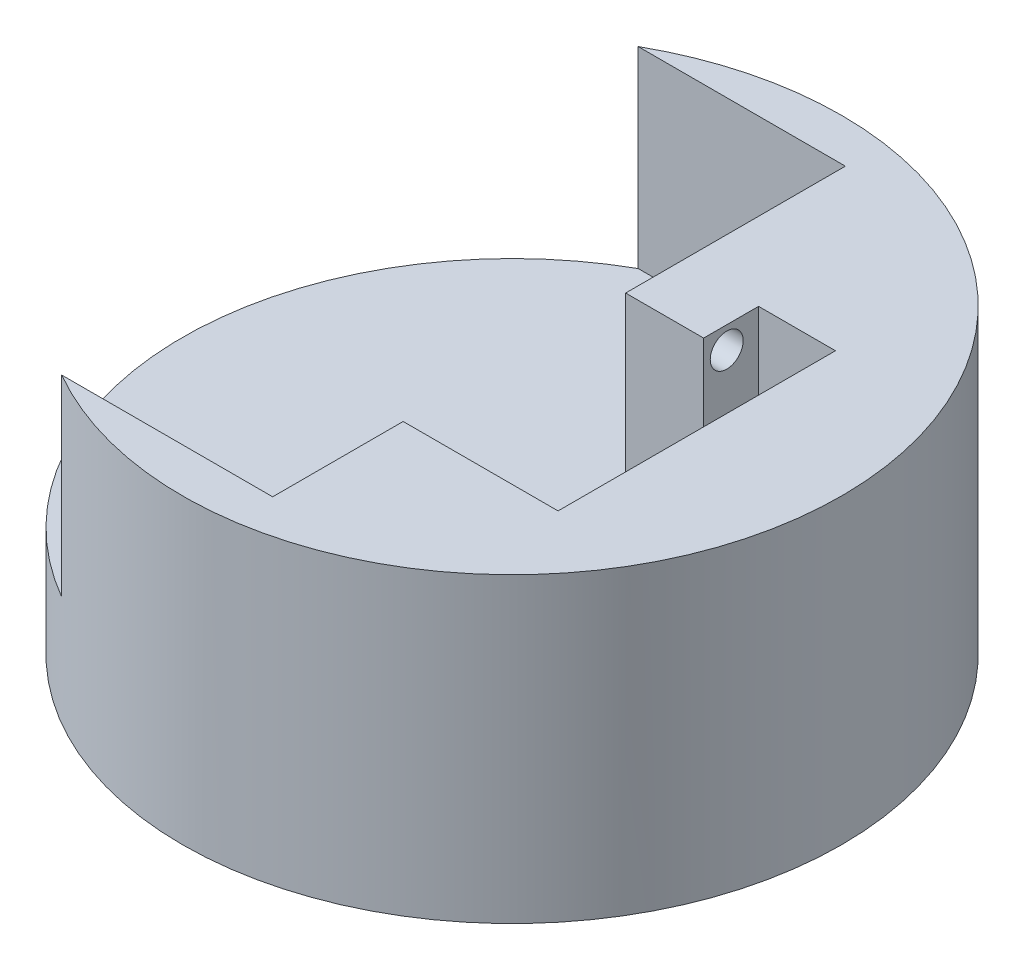
from build123d import *

# Parameters (mm, degrees)
SKETCH2_R           = 60
BOSS_EXTRUDE1_DEPTH = 30
BOSS_EXTRUDE2_START = 10
SKETCH9_R           = 60
BOSS_EXTRUDE2_DEPTH = 10
CUT_EXTRUDE23_DEPTH = 2
BOSS_EXTRUDE5_START = 15
SKETCH15_R          = 60
BOSS_EXTRUDE5_DEPTH = 15
CUT_EXTRUDE25_DEPTH = 35
SKETCH17_R          = 3
CUT_EXTRUDE26_DEPTH = 23
SKETCH18_R          = 52.258613217
CUT_EXTRUDE27_DEPTH = 5
BOSS_EXTRUDE7_DEPTH = 2


with BuildPart() as part:
    # Sketch2 → Boss-Extrude1 (new body)
    with BuildSketch(Plane(origin=(0, 0, 0), x_dir=(1, 0, 0), z_dir=(0, 1, 0))):
        with Locations(Location((0, 0, 0), (0, 0, 270))):
            Circle(SKETCH2_R)
    extrude(amount=BOSS_EXTRUDE1_DEPTH)

    # Sketch9 → Boss-Extrude2 (add)
    with BuildSketch(Plane(origin=(0, 0, 0), x_dir=(-1, 0, 0), z_dir=(0, -1, 0)).offset(BOSS_EXTRUDE2_START)):
        with Locations(Location((0, 0, 0), (0, 0, 90))):
            Circle(SKETCH9_R)
    extrude(amount=-BOSS_EXTRUDE2_DEPTH)

    # Sketch10 → Cut-Extrude23 (cut)
    with BuildSketch(Plane.XZ.offset(10)):
        with BuildLine():
            Line((0, 0), (9.846066319, 0))
            Line((9.846066319, 0), (12.609620792, -2.763554473))
            Line((12.609620792, -2.763554473), (19.082885562, -2.763554473))
            Line((19.082885562, -2.763554473), (20.727798578, 1.93826551))
            Line((20.727798578, 1.93826551), (21.803318626, 0.862745462))
            Line((21.803318626, 0.862745462), (27.750311837, 0.862745462))
            Line((27.750311837, 0.862745462), (28.825831886, 1.93826551))
            Line((28.825831886, 1.93826551), (30.470744902, -2.763554473))
            Line((30.470744902, -2.763554473), (36.944009671, -2.763554473))
            Line((36.944009671, -2.763554473), (39.707564144, 0))
            Line((39.707564144, 0), (49.553630464, 0))
            ThreePointArc((49.553630464, 0), (42.261211549, -3.211698163), (39.707564144, -10.759761734))
            ThreePointArc((39.707564144, -10.759761734), (32.871459875, -12.672701881), (27.1831321, -16.919416931))
            Line((27.1831321, -16.919416931), (25.802519728, -14.051991236))
            Line((25.802519728, -14.051991236), (23.751110736, -14.051991236))
            Line((23.751110736, -14.051991236), (22.370498364, -16.919416931))
            ThreePointArc((22.370498364, -16.919416931), (16.682170589, -12.672701881), (9.846066319, -10.759761734))
            ThreePointArc((9.846066319, -10.759761734), (7.292418915, -3.211698163), (0, 0))
        make_face()
    extrude(amount=-CUT_EXTRUDE23_DEPTH, mode=Mode.SUBTRACT)

    # Sketch15 → Boss-Extrude5 (add)
    with BuildSketch(Plane(origin=(0, -10, 0), x_dir=(-1, 0, 0), z_dir=(0, -1, 0)).offset(BOSS_EXTRUDE5_START)):
        with Locations(Location((0, 0, 0), (0, 0, 90))):
            Circle(SKETCH15_R)
    extrude(amount=-BOSS_EXTRUDE5_DEPTH)

    # Sketch3 → Cut-Extrude25 (cut)
    with BuildSketch(Plane(origin=(0, 30, 0), x_dir=(1, 0, 0), z_dir=(0, 1, 0))):
        with BuildLine():
            Line((22.548874047, 12.322345615), (8.348874047, 12.322345615))
            Line((8.348874047, 12.322345615), (8.348874047, 22.322345615))
            Line((8.348874047, 22.322345615), (8.348874047, 52.322345615))
            Line((8.348874047, 52.322345615), (5.968874047, 52.322345615))
            Line((5.968874047, 52.322345615), (-19.031125953, 52.322345615))
            Line((-19.031125953, 52.322345615), (-29.366173556, 52.322345615))
            ThreePointArc((-29.366173556, 52.322345615), (-81.494201087, 0.194318085), (-29.366173556, -51.933709446))
            Line((-29.366173556, -51.933709446), (-19.031125953, -51.933709446))
            Line((-19.031125953, -51.933709446), (5.968874047, -51.933709446))
            Line((5.968874047, -51.933709446), (8.348874047, -51.933709446))
            Line((8.348874047, -51.933709446), (8.348874047, -41.177654385))
            Line((8.348874047, -41.177654385), (8.348874047, -28.177654385))
            Line((8.348874047, -28.177654385), (36.548874047, -28.177654385))
            Line((36.548874047, -28.177654385), (36.548874047, 12.322345615))
            Line((36.548874047, 12.322345615), (36.548874047, 22.322345615))
            Line((36.548874047, 22.322345615), (22.548874047, 22.322345615))
            Line((22.548874047, 22.322345615), (22.548874047, 12.322345615))
        make_face()
    extrude(amount=-CUT_EXTRUDE25_DEPTH, mode=Mode.SUBTRACT)

    # Sketch17 → Cut-Extrude26 (cut)
    with BuildSketch(Plane.ZY.offset(-8.348874047)):
        with Locations((-16.522345615, 26)):
            Circle(SKETCH17_R)
        with Locations((32.377654385, 26)):
            Circle(SKETCH17_R)
    extrude(amount=-CUT_EXTRUDE26_DEPTH, mode=Mode.SUBTRACT)

    # Sketch18 → Cut-Extrude27 (cut)
    with BuildSketch(Plane.XZ.offset(25)):
        with Locations(Location((0, 0, 0), (0, 0, 270))):
            Circle(SKETCH18_R)
    extrude(amount=-CUT_EXTRUDE27_DEPTH, mode=Mode.SUBTRACT)

    # Sketch19 → Boss-Extrude7 (add)
    # profile 1 of 6: a face of its own
    with BuildSketch(Plane.ZY.offset(-8.348874047)):
        with BuildLine():
            Line((-45.204952465, -0.091098514), (-44.522059837, -0.091098514))
            add(Edge.make_bspline(
                [(-44.522059837, -0.091098514), (-44.488631358, -0.091274264), (-44.423838648, -0.091614912), (-44.329619206, -0.096898043), (-44.241370396, -0.104101713), (-44.159066623, -0.115531806), (-44.082745921, -0.129323583), (-44.012178284, -0.146025399), (-43.947588111, -0.166052013), (-43.870475375, -0.197898294), (-43.782554714, -0.245221462), (-43.687356321, -0.315150027), (-43.605952082, -0.400682491), (-43.535765765, -0.497165146), (-43.479964645, -0.603300918), (-43.439595348, -0.716560107), (-43.414037473, -0.835481848), (-43.411409038, -0.917125026), (-43.41008067, -0.958386174)],
                knots=[0, 0, 0, 0, 1.001505555, 1.941167018, 2.826882275, 3.653841531, 4.429895133, 5.150066043, 5.825578002, 6.45369114, 7.647487171, 8.808567382, 9.977351308, 11.170798116, 12.373658725, 13.556498008, 14.765093433, 16, 16, 16, 16], degree=3))
            add(Edge.make_bspline(
                [(-43.41008067, -0.958386174), (-43.411173888, -0.99703873), (-43.413322166, -1.072994647), (-43.433864925, -1.184088756), (-43.466025594, -1.289839975), (-43.510730843, -1.38986236), (-43.568832839, -1.481895973), (-43.637691158, -1.566683239), (-43.72076796, -1.640634296), (-43.7830112, -1.681977199), (-43.814627946, -1.70297752)],
                knots=[0, 0, 0, 0, 1.044552857, 2.05264487, 3.044412934, 4.028983338, 5.005914585, 5.980388656, 6.974128949, 8, 8, 8, 8], degree=3))
            add(Edge.make_bspline(
                [(-43.814627946, -1.70297752), (-43.774867518, -1.718242519), (-43.698795971, -1.747448243), (-43.594109958, -1.799083707), (-43.503915113, -1.855245818), (-43.427517967, -1.916577668), (-43.362180312, -1.982686479), (-43.305127371, -2.054541593), (-43.256445997, -2.133080351), (-43.214733073, -2.217483886), (-43.182184317, -2.306890355), (-43.157808413, -2.400461131), (-43.143840963, -2.497860686), (-43.141853322, -2.564146065), (-43.140849901, -2.59760893)],
                knots=[0, 0, 0, 0, 1.27268992, 2.434971085, 3.483601985, 4.442670788, 5.356604649, 6.2567628, 7.179492994, 8.113709626, 9.066344395, 10.018646069, 10.999752585, 12, 12, 12, 12], degree=3))
            add(Edge.make_bspline(
                [(-43.140849901, -2.59760893), (-43.141826747, -2.631775803), (-43.143748719, -2.699000081), (-43.15792869, -2.797755215), (-43.181937797, -2.892130162), (-43.215008944, -2.982735344), (-43.258171258, -3.069395479), (-43.310699223, -3.152208743), (-43.373330786, -3.230343074), (-43.443393655, -3.304666697), (-43.522655801, -3.371494484), (-43.608171556, -3.431010191), (-43.701017876, -3.479956253), (-43.79966987, -3.521072274), (-43.905234186, -3.552479473), (-44.017236793, -3.574452047), (-44.135581095, -3.589257084), (-44.216790846, -3.590474289), (-44.258438042, -3.591098514)],
                knots=[0, 0, 0, 0, 0.978564426, 1.925352924, 2.850884081, 3.763762016, 4.682927383, 5.618979971, 6.567305752, 7.547517671, 8.540179244, 9.531824382, 10.526200242, 11.540722885, 12.589160233, 13.674978461, 14.80764778, 16, 16, 16, 16], degree=3))
            Line((-44.258438042, -3.591098514), (-45.204952465, -3.591098514))
            Line((-45.204952465, -3.591098514), (-45.204952465, -0.091098514))
        make_face()
        with BuildLine():
            Line((-44.890849901, -0.450072873), (-44.890849901, -1.571867744))
            Line((-44.890849901, -1.571867744), (-44.67981224, -1.571867744))
            add(Edge.make_bspline(
                [(-44.67981224, -1.571867744), (-44.648963445, -1.571467821), (-44.589357286, -1.570695089), (-44.503037389, -1.568481572), (-44.422912371, -1.562283528), (-44.349120538, -1.556087266), (-44.281778094, -1.546012679), (-44.221034233, -1.534020556), (-44.165935636, -1.521337651), (-44.10239609, -1.499768164), (-44.030323142, -1.467890488), (-43.953490037, -1.418418652), (-43.885755568, -1.359494299), (-43.82855838, -1.291503337), (-43.78174691, -1.216637152), (-43.749233194, -1.136090271), (-43.72718591, -1.051870139), (-43.725194379, -0.994051886), (-43.724183234, -0.96469627)],
                knots=[0, 0, 0, 0, 1.156816544, 2.235205308, 3.236616184, 4.169592532, 5.011045266, 5.787822928, 6.49130361, 7.128639758, 8.301311294, 9.436451833, 10.541879658, 11.654887649, 12.756523258, 13.837046038, 14.901820046, 16, 16, 16, 16], degree=3))
            add(Edge.make_bspline(
                [(-43.724183234, -0.96469627), (-43.724709414, -0.945270499), (-43.725741574, -0.907164727), (-43.734194877, -0.851615372), (-43.748562451, -0.79937162), (-43.767016744, -0.74971751), (-43.792805433, -0.704205659), (-43.823168896, -0.661262464), (-43.859854587, -0.622350345), (-43.901611899, -0.585980847), (-43.949620522, -0.553736319), (-44.003851814, -0.525495556), (-44.065039491, -0.502754779), (-44.132152346, -0.482838627), (-44.206223434, -0.468850333), (-44.286397987, -0.457196945), (-44.373332706, -0.451264203), (-44.433477809, -0.45047884), (-44.464567849, -0.450072873)],
                knots=[0, 0, 0, 0, 0.91205012, 1.789085906, 2.630437955, 3.453916878, 4.269457761, 5.079663411, 5.91843418, 6.774407191, 7.675494373, 8.627863946, 9.638891023, 10.736472738, 11.911756761, 13.175263542, 14.539845004, 16, 16, 16, 16], degree=3))
            Line((-44.464567849, -0.450072873), (-44.890849901, -0.450072873))
        make_face(mode=Mode.SUBTRACT)
        with BuildLine():
            Line((-44.890849901, -1.930842103), (-44.890849901, -3.232124155))
            Line((-44.890849901, -3.232124155), (-44.443534196, -3.232124155))
            add(Edge.make_bspline(
                [(-44.443534196, -3.232124155), (-44.41151527, -3.231740407), (-44.349803011, -3.231000785), (-44.260701781, -3.22858623), (-44.178118677, -3.223093955), (-44.102430541, -3.214448105), (-44.032820089, -3.205069656), (-43.970122386, -3.192458375), (-43.913829192, -3.178009414), (-43.848554885, -3.155675242), (-43.775051376, -3.120978771), (-43.69584052, -3.068664545), (-43.625414302, -3.006341237), (-43.565609043, -2.934210323), (-43.516596054, -2.855778996), (-43.480940599, -2.772633646), (-43.458949742, -2.686148118), (-43.456287573, -2.627181406), (-43.454952465, -2.59760893)],
                knots=[0, 0, 0, 0, 1.160039823, 2.235823828, 3.228722157, 4.157150951, 4.99529583, 5.772374946, 6.472645482, 7.099169577, 8.269452708, 9.405989375, 10.527446681, 11.663510218, 12.788923519, 13.866172445, 14.929861265, 16, 16, 16, 16], degree=3))
            add(Edge.make_bspline(
                [(-43.454952465, -2.59760893), (-43.455228569, -2.57911559), (-43.455776324, -2.542427208), (-43.464036939, -2.488511389), (-43.476050809, -2.436285516), (-43.491582243, -2.385607775), (-43.51420171, -2.337394399), (-43.540608255, -2.290691839), (-43.571569657, -2.24543836), (-43.619813822, -2.188226106), (-43.689985807, -2.122309093), (-43.789692582, -2.057771591), (-43.90306488, -2.005723784), (-43.985292373, -1.983624308), (-44.027768971, -1.972208289)],
                knots=[0, 0, 0, 0, 0.723448775, 1.435228256, 2.130040452, 2.821711965, 3.505591119, 4.210454504, 4.921174351, 5.648778258, 7.137944449, 8.670945889, 10.280296675, 12, 12, 12, 12], degree=3))
            add(Edge.make_bspline(
                [(-44.027768971, -1.972208289), (-44.044798067, -1.968753205), (-44.081720659, -1.961261871), (-44.14192824, -1.953354167), (-44.210664109, -1.946309107), (-44.288086986, -1.94109795), (-44.374294827, -1.935711406), (-44.469471746, -1.933616585), (-44.57322906, -1.931117325), (-44.645221433, -1.930936191), (-44.682616728, -1.930842103)],
                knots=[0, 0, 0, 0, 0.634451884, 1.375622551, 2.216452059, 3.157844607, 4.20941857, 5.370758133, 6.634282058, 8, 8, 8, 8], degree=3))
            Line((-44.682616728, -1.930842103), (-44.890849901, -1.930842103))
        make_face(mode=Mode.SUBTRACT)
    # profile 2 of 6: a face of its own
    with BuildSketch(Plane.ZY.offset(-8.348874047)):
        Polygon((-40.987003747, -0.091098514), (-39.371619131, -3.591098514), (-39.713065446, -3.591098514), (-40.23049333, -2.469303642), (-41.817131952, -2.469303642), (-42.348582273, -3.591098514), (-42.692131952, -3.591098514), (-41.031875542, -0.091098514), align=None)
        Polygon((-41.012945253, -0.773991142), (-41.646058234, -2.110329283), (-40.395958074, -2.110329283), align=None, mode=Mode.SUBTRACT)
    # profile 3 of 6: a face of its own
    with BuildSketch(Plane.ZY.offset(-8.348874047)):
        Polygon((-39.147260157, -0.450072873), (-39.147260157, -0.091098514), (-37.307516567, -0.091098514), (-37.307516567, -0.450072873), (-38.07033708, -0.450072873), (-38.07033708, -3.591098514), (-38.384439644, -3.591098514), (-38.384439644, -0.450072873), align=None)
    # profile 4 of 6: a face of its own
    with BuildSketch(Plane.ZY.offset(-8.348874047)):
        Polygon((-35.333157593, -0.091098514), (-33.717772978, -3.591098514), (-34.059219292, -3.591098514), (-34.576647176, -2.469303642), (-36.163285798, -2.469303642), (-36.694736119, -3.591098514), (-37.038285798, -3.591098514), (-35.378029388, -0.091098514), align=None)
        Polygon((-35.359099099, -0.773991142), (-35.99221208, -2.110329283), (-34.74211192, -2.110329283), align=None, mode=Mode.SUBTRACT)
    # profile 5 of 6: a face of its own
    with BuildSketch(Plane.ZY.offset(-8.348874047)):
        with BuildLine():
            Line((-33.089567849, -0.091098514), (-32.389147176, -0.091098514))
            add(Edge.make_bspline(
                [(-32.389147176, -0.091098514), (-32.342406048, -0.0912541), (-32.252657903, -0.091552842), (-32.124084633, -0.093218605), (-32.007257536, -0.097992961), (-31.902237697, -0.102101544), (-31.809027042, -0.109593485), (-31.727339751, -0.116754133), (-31.657552054, -0.126127793), (-31.615306202, -0.134833216), (-31.596178426, -0.138774796)],
                knots=[0, 0, 0, 0, 1.410062039, 2.707475311, 3.878576406, 4.937260626, 5.877586885, 6.699081471, 7.410979367, 8, 8, 8, 8], degree=3))
            add(Edge.make_bspline(
                [(-31.596178426, -0.138774796), (-31.570571802, -0.145101561), (-31.519904813, -0.157620125), (-31.446954747, -0.184079726), (-31.377440423, -0.21469935), (-31.311650598, -0.250663071), (-31.249914807, -0.29223785), (-31.191596496, -0.338705973), (-31.136431033, -0.389813178), (-31.086649403, -0.44684802), (-31.039710351, -0.50668453), (-31.000121725, -0.571388286), (-30.965995245, -0.639049814), (-30.938824728, -0.710357232), (-30.916946755, -0.784619004), (-30.901520515, -0.8625078), (-30.892269328, -0.943668775), (-30.891327472, -0.999026684), (-30.890849901, -1.02709611)],
                knots=[0, 0, 0, 0, 1.027469482, 2.033020251, 3.019912614, 3.986113645, 4.951240523, 5.91722682, 6.890402269, 7.87763091, 8.8651537, 9.85103654, 10.82876324, 11.815024772, 12.821070561, 13.842952187, 14.906261191, 16, 16, 16, 16], degree=3))
            add(Edge.make_bspline(
                [(-30.890849901, -1.02709611), (-30.892318899, -1.073731214), (-30.895185295, -1.164728382), (-30.921910398, -1.296789264), (-30.965686918, -1.419978578), (-31.026010207, -1.534141216), (-31.102829683, -1.637051862), (-31.195154474, -1.727442317), (-31.303036085, -1.80308223), (-31.403465401, -1.855535034), (-31.492179601, -1.889127943), (-31.565212914, -1.912764302), (-31.644879891, -1.931026267), (-31.730417226, -1.947386399), (-31.822180881, -1.959738093), (-31.919950921, -1.968784688), (-32.023797072, -1.974438736), (-32.095136142, -1.975280741), (-32.131835478, -1.975713898)],
                knots=[0, 0, 0, 0, 1.260483769, 2.459530307, 3.627416485, 4.787058657, 5.939039949, 7.08810263, 8.267026773, 9.491475466, 10.141966685, 10.831826277, 11.566392101, 12.351337768, 13.187381173, 14.07005841, 15.007169909, 16, 16, 16, 16], degree=3))
            Line((-32.131835478, -1.975713898), (-30.845978106, -3.591098514))
            Line((-30.845978106, -3.591098514), (-31.23439958, -3.591098514))
            Line((-31.23439958, -3.591098514), (-32.520256952, -1.975713898))
            Line((-32.520256952, -1.975713898), (-32.775465285, -1.975713898))
            Line((-32.775465285, -1.975713898), (-32.775465285, -3.591098514))
            Line((-32.775465285, -3.591098514), (-33.089567849, -3.591098514))
            Line((-33.089567849, -3.591098514), (-33.089567849, -0.091098514))
        make_face()
        with BuildLine():
            Line((-32.775465285, -0.450072873), (-32.775465285, -1.616739539))
            Line((-32.775465285, -1.616739539), (-32.134639965, -1.621647392))
            add(Edge.make_bspline(
                [(-32.134639965, -1.621647392), (-32.104719926, -1.621660629), (-32.046726369, -1.621686285), (-31.962825704, -1.617692509), (-31.884705592, -1.613149191), (-31.81266484, -1.606199845), (-31.746671265, -1.597243773), (-31.686757852, -1.586040789), (-31.6328268, -1.572988726), (-31.569928261, -1.552787101), (-31.49969173, -1.520781082), (-31.42336027, -1.474215584), (-31.358357932, -1.415646464), (-31.30344007, -1.348673008), (-31.259310638, -1.27503676), (-31.228198584, -1.19562039), (-31.208456142, -1.112428792), (-31.206127596, -1.055250684), (-31.204952465, -1.026394988)],
                knots=[0, 0, 0, 0, 1.146690395, 2.22261258, 3.21895312, 4.145990853, 4.996080663, 5.770904154, 6.481378293, 7.121626537, 8.300444488, 9.431385265, 10.535395872, 11.636531494, 12.74115979, 13.810798291, 14.895190096, 16, 16, 16, 16], degree=3))
            add(Edge.make_bspline(
                [(-31.204952465, -1.026394988), (-31.206154586, -0.998248414), (-31.208536751, -0.942472176), (-31.22798552, -0.860816265), (-31.260874901, -0.783749315), (-31.305197139, -0.71158483), (-31.359196294, -0.646079094), (-31.422514107, -0.590031941), (-31.493419302, -0.543782477), (-31.5596905, -0.514228096), (-31.618924713, -0.496108243), (-31.670354373, -0.483357079), (-31.72846585, -0.47311261), (-31.793541309, -0.464904549), (-31.86530294, -0.457849605), (-31.944113591, -0.453097826), (-32.029450371, -0.450283962), (-32.088597302, -0.450144873), (-32.119215285, -0.450072873)],
                knots=[0, 0, 0, 0, 1.101028733, 2.181837193, 3.264309656, 4.369019818, 5.486613113, 6.575447106, 7.666700264, 8.788928104, 9.402425223, 10.0903467, 10.862060571, 11.710948788, 12.657782767, 13.684531032, 14.801375019, 16, 16, 16, 16], degree=3))
            Line((-32.119215285, -0.450072873), (-32.775465285, -0.450072873))
        make_face(mode=Mode.SUBTRACT)
    # profile 6 of 6: a face of its own
    with BuildSketch(Plane.ZY.offset(-8.348874047)):
        Polygon((-30.307516567, -3.591098514), (-29.845477305, -0.091098514), (-29.80060551, -0.091098514), (-28.35559349, -2.962893386), (-26.914788202, -0.091098514), (-26.869916407, -0.091098514), (-26.403670414, -3.591098514), (-26.717772978, -3.591098514), (-27.054311439, -1.074772392), (-28.317031792, -3.591098514), (-28.388546215, -3.591098514), (-29.656875542, -1.067060052), (-29.991310638, -3.591098514), align=None)
    extrude(amount=BOSS_EXTRUDE7_DEPTH)


solid = part.part
